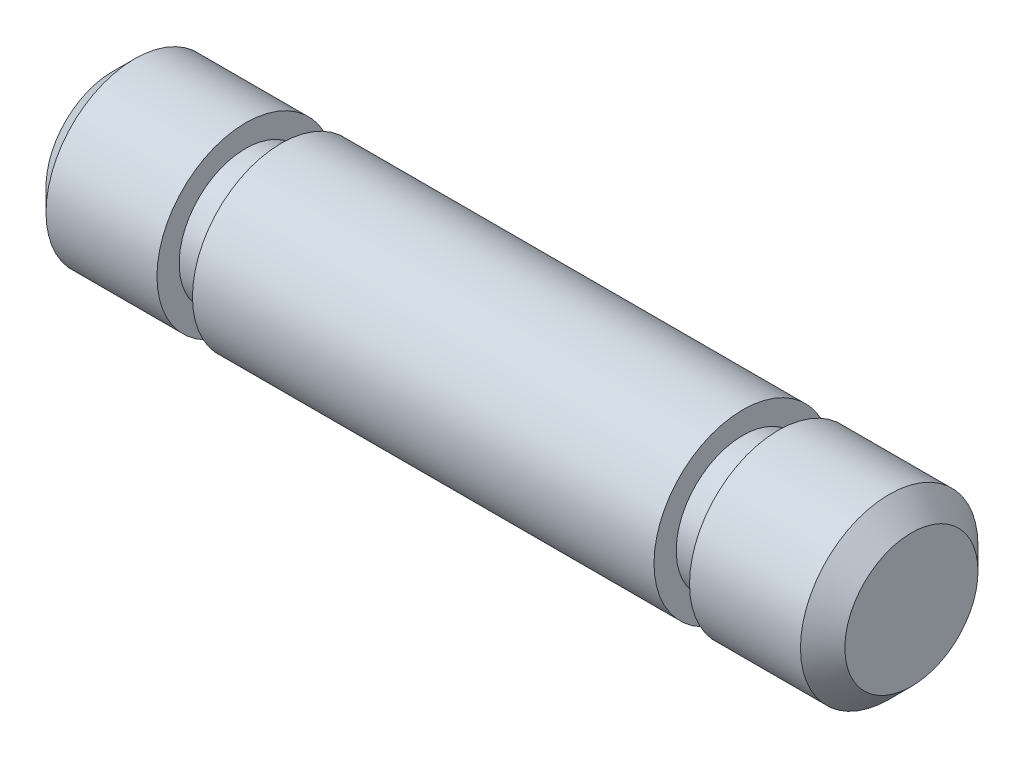
from build123d import *

# Parameters (mm, degrees)
SKETCH1_R           = 2
BOSS_EXTRUDE1_DEPTH = 9
CHAMFER1_SIZE       = 0.5
CUT_EXTRUDE1_START  = -3
SKETCH2_R           = 2
SKETCH2_R_2         = 1.5
CUT_EXTRUDE1_DEPTH  = 0.8


with BuildPart() as part:
    # Sketch1 → Boss-Extrude1 (new, symmetric)
    with BuildSketch(Plane(origin=(0, 0, 0), x_dir=(0, 0, -1), z_dir=(1, 0, 0))):
        Circle(SKETCH1_R)
    extrude(amount=BOSS_EXTRUDE1_DEPTH, both=True)

    # Chamfer1
    chamfer1_edges = [part.edges().sort_by_distance(p)[0] for p in [
        (-9, 0, 2),
        (9, 0, 2),
    ]]
    chamfer(chamfer1_edges, length=CHAMFER1_SIZE)

    # Sketch2 → Cut-Extrude1 (cut)
    with BuildSketch(Plane(origin=(9, 0, 0), x_dir=(0, 0, -1), z_dir=(1, 0, 0)).offset(CUT_EXTRUDE1_START)):
        Circle(SKETCH2_R)
        Circle(SKETCH2_R_2, mode=Mode.SUBTRACT)
    cut_extrude1 = extrude(amount=-CUT_EXTRUDE1_DEPTH, mode=Mode.SUBTRACT)

    # Mirror1: Cut-Extrude1 across plane
    add(cut_extrude1.mirror(Plane(origin=(0, 0, 0), x_dir=(0, 0, 1), z_dir=(1, 0, 0))), mode=Mode.SUBTRACT)


solid = part.part
